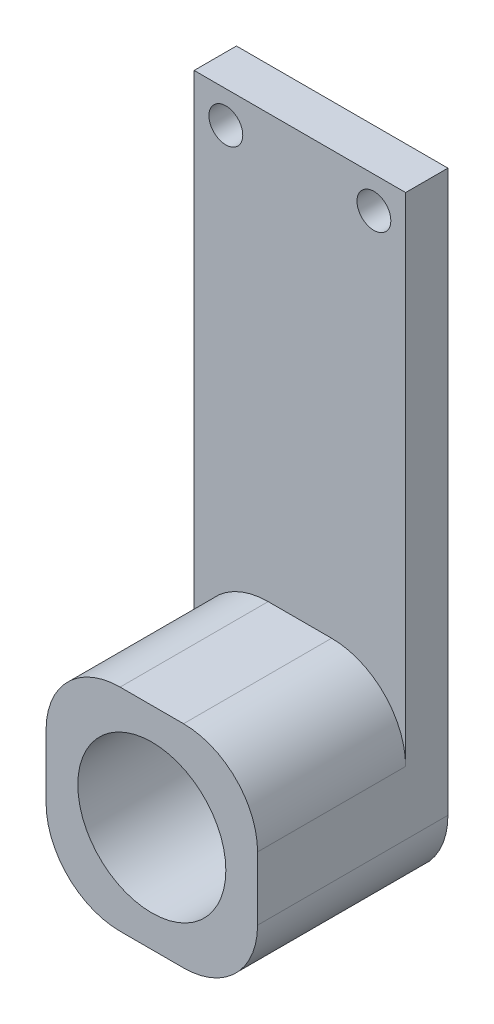
from build123d import *

# Parameters (mm, degrees)
SKETCH1_W           = 10
SKETCH1_H           = 30
BOSS_EXTRUDE1_DEPTH = 2
SKETCH2_W           = 10
SKETCH2_H           = 10
SKETCH2_R           = 3.5
BOSS_EXTRUDE2_DEPTH = 7
SKETCH3_R           = 0.8
CUT_EXTRUDE1_DEPTH  = 2
FILLET1_R           = 3.5
SKETCH4_R           = 1.5
CUT_EXTRUDE2_DEPTH  = 2


with BuildPart() as part:
    # Sketch1 → Boss-Extrude1 (new body)
    with BuildSketch(Plane.XY):
        with Locations((-12.863567867, 6.68847884)):
            Rectangle(SKETCH1_W, SKETCH1_H)
    extrude(amount=BOSS_EXTRUDE1_DEPTH)

    # Sketch2 → Boss-Extrude2 (add)
    with BuildSketch(Plane.XY.offset(2)):
        with Locations((-12.863567867, -3.31152116)):
            Rectangle(SKETCH2_W, SKETCH2_H)
        with Locations((-12.863567867, -3.31152116)):
            Circle(SKETCH2_R, mode=Mode.SUBTRACT)
    extrude(amount=BOSS_EXTRUDE2_DEPTH)

    # Sketch3 → Cut-Extrude1 (cut)
    with BuildSketch(Plane.XY.offset(2)):
        with Locations((-16.363567867, 20.18847884)):
            Circle(SKETCH3_R)
        with Locations((-9.363567867, 20.18847884)):
            Circle(SKETCH3_R)
    extrude(amount=-CUT_EXTRUDE1_DEPTH, mode=Mode.SUBTRACT)

    # Fillet1
    fillet1_edges = [part.edges().sort_by_distance(p)[0] for p in [
        (-7.863567867, -8.31152116, 4.5),
        (-17.863567867, -8.31152116, 4.5),
        (-17.863567867, 1.68847884, 5.5),
        (-7.863567867, 1.68847884, 5.5),
    ]]
    fillet(fillet1_edges, radius=FILLET1_R)

    # Sketch4 → Cut-Extrude2 (cut)
    with BuildSketch(Plane.XY.offset(2)):
        with Locations((-12.863567867, -3.31152116)):
            Circle(SKETCH4_R)
    extrude(amount=-CUT_EXTRUDE2_DEPTH, mode=Mode.SUBTRACT)


solid = part.part
